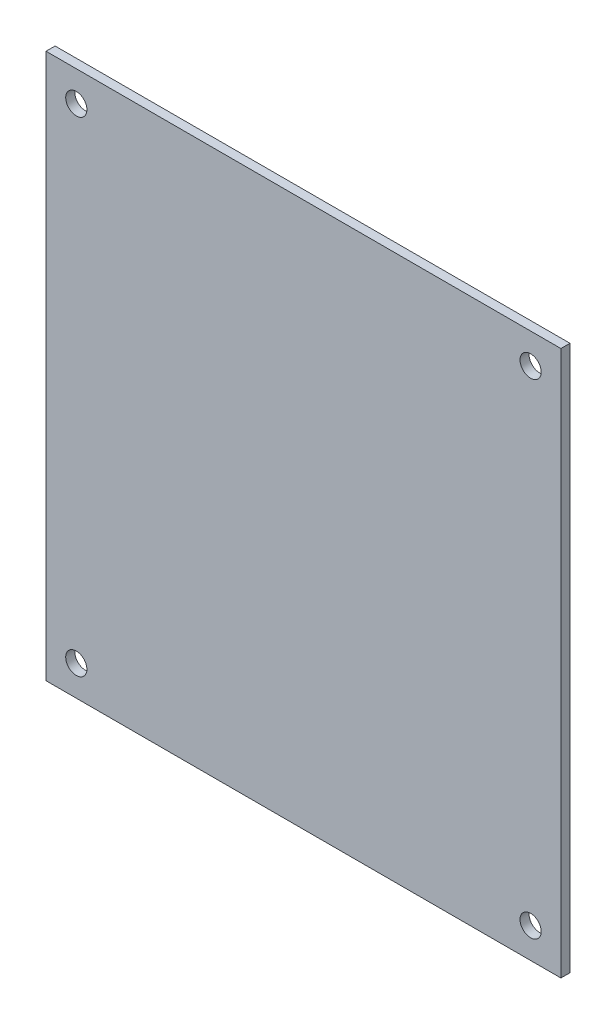
from build123d import *

# Parameters (mm, degrees)
SKETCH_1_W      = 85
SKETCH_1_H      = 90
SKETCH_1_R      = 1.75
EXTRUDE_1_DEPTH = 1.5


with BuildPart() as part:
    # Эскиз1 → Бобышка-Вытянуть1 (new body)
    with BuildSketch(Plane.XY):
        Rectangle(SKETCH_1_W, SKETCH_1_H)
        with Locations((-37.5, -40)):
            Circle(SKETCH_1_R, mode=Mode.SUBTRACT)
        with Locations((37.5, -40)):
            Circle(SKETCH_1_R, mode=Mode.SUBTRACT)
        with Locations((37.5, 40)):
            Circle(SKETCH_1_R, mode=Mode.SUBTRACT)
        with Locations((-37.5, 40)):
            Circle(SKETCH_1_R, mode=Mode.SUBTRACT)
    extrude(amount=EXTRUDE_1_DEPTH)


solid = part.part
